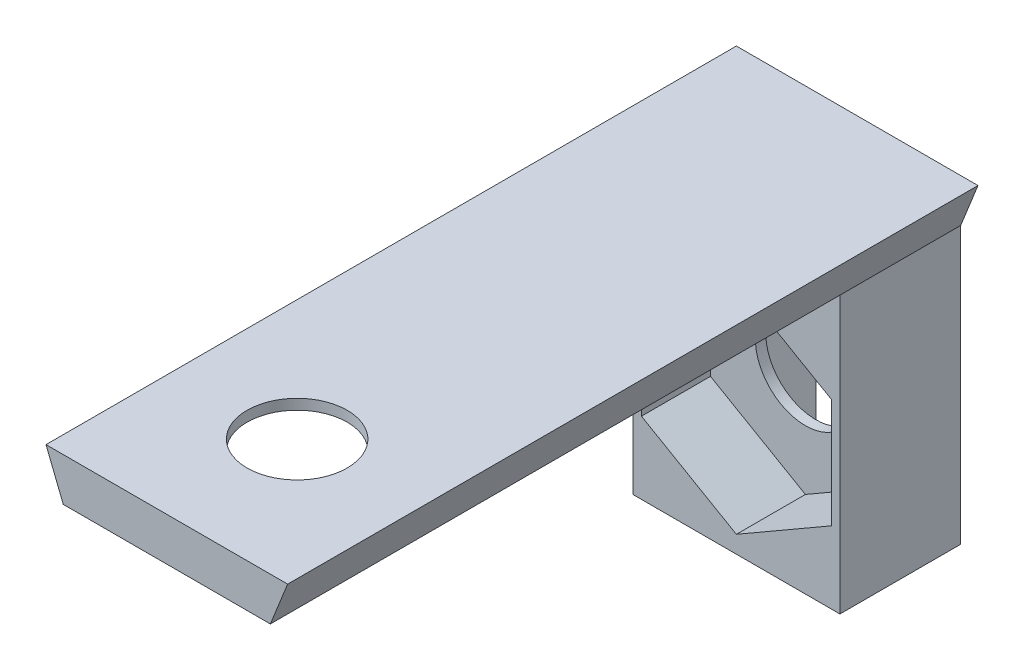
from build123d import *

# Parameters (mm, degrees)
SKETCH1_W           = 12
SKETCH1_H           = 7
BOSS_EXTRUDE1_DEPTH = 16
CUT_EXTRUDE1_DEPTH  = 20
CUT_EXTRUDE2_REACH  = 20.466
SKETCH3_R           = 2.9
CUT_EXTRUDE3_DEPTH  = 4
SKETCH5_W           = 14
SKETCH5_H           = 40
BOSS_EXTRUDE2_DEPTH = 2.5
CUT_EXTRUDE4_REACH  = 46.623
CUT_EXTRUDE6_DEPTH  = 1.9
CUT_EXTRUDE7_REACH  = 43.251
SKETCH9_R           = 2.9


with BuildPart() as part:
    # Sketch1 → Boss-Extrude1 (new body)
    with BuildSketch(Plane(origin=(0, 0, 0), x_dir=(1, 0, 0), z_dir=(0, 1, 0))):
        Rectangle(SKETCH1_W, SKETCH1_H)
    extrude(amount=BOSS_EXTRUDE1_DEPTH)

    # Sketch2 → Cut-Extrude1 (cut)
    with BuildSketch(Plane(origin=(0, 16, 0), x_dir=(1, 0, 0), z_dir=(0, 1, 0))):
        Polygon((0, 3.5), (2.4, 3.5), (4.8, 1.1), (0, 1.1), (-4.8, 1.1), (-2.4, 3.5), align=None)
    extrude(amount=-CUT_EXTRUDE1_DEPTH, mode=Mode.SUBTRACT)

    # Sketch3 → Cut-Extrude2 (cut, up to next)
    with BuildSketch(Plane.XY.offset(3.5), mode=Mode.PRIVATE) as cut_extrude2_sk1:
        with Locations((0, 7.35)):
            Circle(SKETCH3_R)
    cut_extrude2_tool1 = extrude(cut_extrude2_sk1.sketch, amount=-CUT_EXTRUDE2_REACH, mode=Mode.PRIVATE) & part.part
    add(cut_extrude2_tool1.solids().sort_by_distance((0, 7.35, 3.5))[0], mode=Mode.SUBTRACT)

    # Sketch4 → Cut-Extrude3 (cut)
    with BuildSketch(Plane.XY.offset(3.5)):
        Polygon((0, 13.700852961), (-5.5, 10.525426481), (-5.5, 4.174573519), (0, 0.999147039), (5.5, 4.174573519), (5.5, 10.525426481), align=None)
    extrude(amount=-CUT_EXTRUDE3_DEPTH, mode=Mode.SUBTRACT)

    # Sketch5 → Boss-Extrude2 (add)
    with BuildSketch(Plane(origin=(0, 16, 0), x_dir=(1, 0, 0), z_dir=(0, 1, 0))):
        with Locations((0, -16.5)):
            Rectangle(SKETCH5_W, SKETCH5_H)
    extrude(amount=BOSS_EXTRUDE2_DEPTH)

    # Sketch6 → Cut-Extrude4 (cut, up to next)
    with BuildSketch(Plane(origin=(0, 0, -3.5), x_dir=(-1, 0, 0), z_dir=(0, 0, -1)), mode=Mode.PRIVATE) as cut_extrude4_sk1:
        Polygon((-7, 16), (-7, 18.5), (-6, 16), align=None)
    cut_extrude4_tool1 = extrude(cut_extrude4_sk1.sketch, amount=-CUT_EXTRUDE4_REACH, mode=Mode.PRIVATE) & part.part
    # Sketch6 → Cut-Extrude4 (cut, up to next)
    with BuildSketch(Plane(origin=(0, 0, -3.5), x_dir=(-1, 0, 0), z_dir=(0, 0, -1)), mode=Mode.PRIVATE) as cut_extrude4_sk2:
        Polygon((7, 16), (6, 16), (7, 18.5), align=None)
    cut_extrude4_tool2 = extrude(cut_extrude4_sk2.sketch, amount=-CUT_EXTRUDE4_REACH, mode=Mode.PRIVATE) & part.part
    add(cut_extrude4_tool1.solids().sort_by_distance((6.666667, 16.833333, -3.5))[0], mode=Mode.SUBTRACT)
    add(cut_extrude4_tool2.solids().sort_by_distance((-6.666667, 16.833333, -3.5))[0], mode=Mode.SUBTRACT)

    # Sketch8 → Cut-Extrude6 (cut)
    with BuildSketch(Plane.XZ.offset(-16)):
        Polygon((0, 22.599147039), (5.5, 25.774573519), (5.5, 32.125426481), (0, 35.300852961), (-5.5, 32.125426481), (-5.5, 25.774573519), align=None)
    extrude(amount=-CUT_EXTRUDE6_DEPTH, mode=Mode.SUBTRACT)

    # Sketch9 → Cut-Extrude7 (cut, up to next)
    with BuildSketch(Plane(origin=(0, 17.9, 0), x_dir=(-1, 0, 0), z_dir=(0, -1, 0)), mode=Mode.PRIVATE) as cut_extrude7_sk1:
        with Locations(Location((0, -28.95, 0), (0, 0, 90))):
            Circle(SKETCH9_R)
    cut_extrude7_tool1 = extrude(cut_extrude7_sk1.sketch, amount=-CUT_EXTRUDE7_REACH, mode=Mode.PRIVATE) & part.part
    add(cut_extrude7_tool1.solids().sort_by_distance((0, 17.9, 28.95))[0], mode=Mode.SUBTRACT)


solid = part.part
